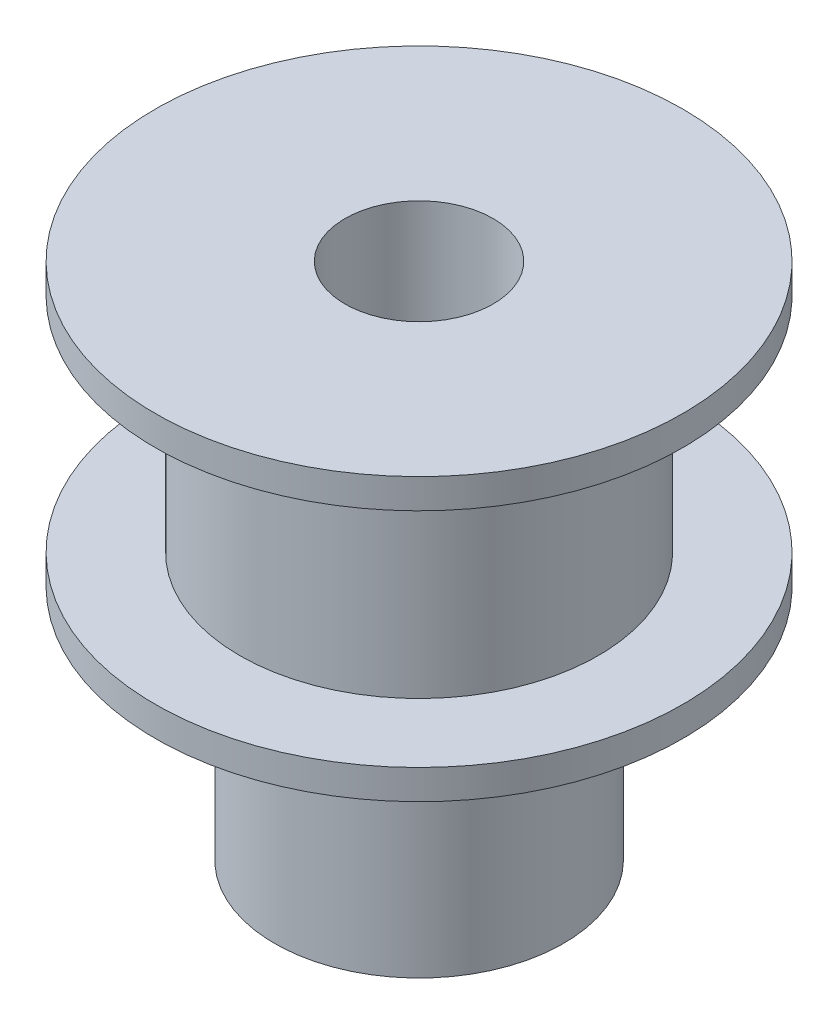
from build123d import *


with BuildPart() as part:
    # Sketch1 → Revolve1 (revolve)
    with BuildSketch(Plane.XY, mode=Mode.PRIVATE) as revolve1_sk:
        Polygon((-2.5, 0), (-2.5, 17.5), (-8.9, 17.5), (-8.9, 16.5), (-6.05, 16.5), (-6.05, 9), (-8.9, 9), (-8.9, 8), (-4.875, 8), (-4.875, 0), align=None)
    revolve(revolve1_sk.sketch.rotate(Axis((0, 0, 0), (0, 1, 0)), 270), axis=Axis((0, 0, 0), (0, 1, 0)))


solid = part.part
